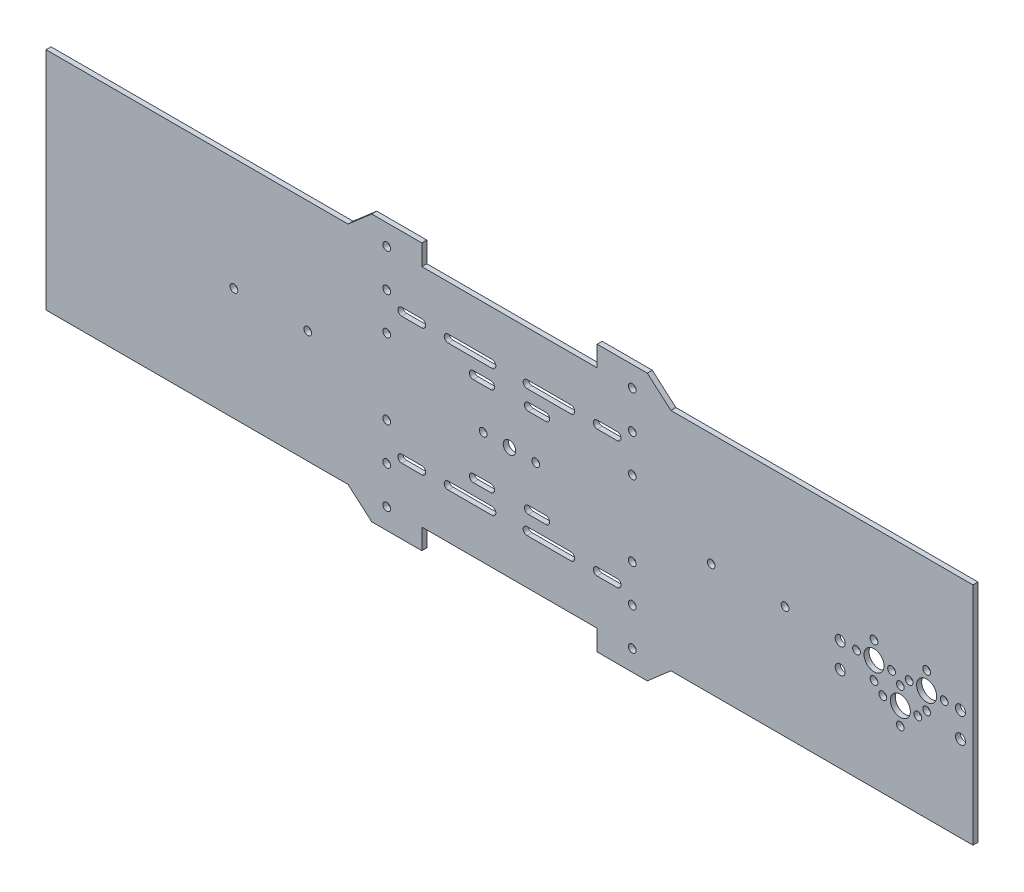
from build123d import *

# Parameters (mm, degrees)
SKETCH_1_R      = 1.55
SKETCH_1_R_2    = 2
SKETCH_1_R_3    = 4
SKETCH_1_R_4    = 2.5
EXTRUDE_1_DEPTH = 2


with BuildPart() as part:
    # 草图1 → 凸台-拉伸1 (new body)
    with BuildSketch(Plane.XY):
        Polygon((-35, 45), (35, 45), (35, 53.2), (55, 53.2), (64.431194454, 45), (185, 45), (185, -45), (64.431194454, -45), (55, -53.2), (35, -53.2), (35, -45), (-35, -45), (-35, -53.2), (-55, -53.2), (-64.431194454, -45), (-185, -45), (-185, 45), (-73.862388908, 45), (-64.431194454, 45), (-55, 53.2), (-35, 53.2), align=None)
        with Locations((49, -30)):
            Circle(SKETCH_1_R, mode=Mode.SUBTRACT)
        with Locations((49, -15)):
            Circle(SKETCH_1_R, mode=Mode.SUBTRACT)
        with Locations((10.5, 0)):
            Circle(SKETCH_1_R, mode=Mode.SUBTRACT)
        with Locations((-10.5, 0)):
            Circle(SKETCH_1_R, mode=Mode.SUBTRACT)
        with Locations((-49, -15)):
            Circle(SKETCH_1_R, mode=Mode.SUBTRACT)
        with Locations((-49, -30)):
            Circle(SKETCH_1_R, mode=Mode.SUBTRACT)
        with Locations((-49, 45)):
            Circle(SKETCH_1_R, mode=Mode.SUBTRACT)
        with Locations((49, 45)):
            Circle(SKETCH_1_R, mode=Mode.SUBTRACT)
        with Locations((-49, 30)):
            Circle(SKETCH_1_R, mode=Mode.SUBTRACT)
        with Locations((-49, 15)):
            Circle(SKETCH_1_R, mode=Mode.SUBTRACT)
        with Locations((49, 15)):
            Circle(SKETCH_1_R, mode=Mode.SUBTRACT)
        with Locations((49, 30)):
            Circle(SKETCH_1_R, mode=Mode.SUBTRACT)
        with Locations((49, -45)):
            Circle(SKETCH_1_R, mode=Mode.SUBTRACT)
        with Locations((-49, -45)):
            Circle(SKETCH_1_R, mode=Mode.SUBTRACT)
        with Locations((-80.5, 0)):
            Circle(SKETCH_1_R, mode=Mode.SUBTRACT)
        with Locations((-110, 0)):
            Circle(SKETCH_1_R, mode=Mode.SUBTRACT)
        with Locations((80.5, 0)):
            Circle(SKETCH_1_R, mode=Mode.SUBTRACT)
        with Locations((110, 0)):
            Circle(SKETCH_1_R, mode=Mode.SUBTRACT)
        with Locations((132, -0.8)):
            Circle(SKETCH_1_R_2, mode=Mode.SUBTRACT)
        with Locations((132, -10.8)):
            Circle(SKETCH_1_R_2, mode=Mode.SUBTRACT)
        with Locations((145.5, -0.8)):
            Circle(SKETCH_1_R_3, mode=Mode.SUBTRACT)
        with Locations((145.5, 6.2)):
            Circle(SKETCH_1_R, mode=Mode.SUBTRACT)
        with Locations((138.5, -0.8)):
            Circle(SKETCH_1_R, mode=Mode.SUBTRACT)
        with Locations((152.5, -0.8)):
            Circle(SKETCH_1_R, mode=Mode.SUBTRACT)
        with Locations((145.5, -7.8)):
            Circle(SKETCH_1_R, mode=Mode.SUBTRACT)
        with Locations((149, -11.3)):
            Circle(SKETCH_1_R, mode=Mode.SUBTRACT)
        with Locations((156, -4.3)):
            Circle(SKETCH_1_R, mode=Mode.SUBTRACT)
        with Locations((180, -10.8)):
            Circle(SKETCH_1_R_2, mode=Mode.SUBTRACT)
        with Locations((180, -0.8)):
            Circle(SKETCH_1_R_2, mode=Mode.SUBTRACT)
        with Locations((156, -18.3)):
            Circle(SKETCH_1_R, mode=Mode.SUBTRACT)
        with Locations((163, -11.3)):
            Circle(SKETCH_1_R, mode=Mode.SUBTRACT)
        with Locations((156, -11.3)):
            Circle(SKETCH_1_R_3, mode=Mode.SUBTRACT)
        with Locations((166.5, -0.8)):
            Circle(SKETCH_1_R_3, mode=Mode.SUBTRACT)
        with Locations((159.5, -0.8)):
            Circle(SKETCH_1_R, mode=Mode.SUBTRACT)
        with Locations((166.5, -7.8)):
            Circle(SKETCH_1_R, mode=Mode.SUBTRACT)
        with Locations((173.5, -0.8)):
            Circle(SKETCH_1_R, mode=Mode.SUBTRACT)
        with Locations((166.5, 6.2)):
            Circle(SKETCH_1_R, mode=Mode.SUBTRACT)
        Circle(SKETCH_1_R_4, mode=Mode.SUBTRACT)
        with BuildLine():
            Line((7.5, -16.25), (14.5, -16.25))
            ThreePointArc((14.5, -16.25), (16.05, -17.8), (14.5, -19.35))
            Line((14.5, -19.35), (7.5, -19.35))
            ThreePointArc((7.5, -19.35), (5.95, -17.8), (7.5, -16.25))
        make_face(mode=Mode.SUBTRACT)
        with BuildLine():
            Line((7, -23.85), (24.5, -23.85))
            ThreePointArc((24.5, -23.85), (26.05, -25.4), (24.5, -26.95))
            Line((24.5, -26.95), (7, -26.95))
            ThreePointArc((7, -26.95), (5.45, -25.4), (7, -23.85))
        make_face(mode=Mode.SUBTRACT)
        with BuildLine():
            Line((35, -23.85), (43, -23.85))
            ThreePointArc((43, -23.85), (44.55, -25.4), (43, -26.95))
            Line((43, -26.95), (35, -26.95))
            ThreePointArc((35, -26.95), (33.45, -25.4), (35, -23.85))
        make_face(mode=Mode.SUBTRACT)
        with BuildLine():
            Line((-35, -23.85), (-43, -23.85))
            ThreePointArc((-43, -23.85), (-44.55, -25.4), (-43, -26.95))
            Line((-43, -26.95), (-35, -26.95))
            ThreePointArc((-35, -26.95), (-33.45, -25.4), (-35, -23.85))
        make_face(mode=Mode.SUBTRACT)
        with BuildLine():
            Line((-7, -23.85), (-24.5, -23.85))
            ThreePointArc((-24.5, -23.85), (-26.05, -25.4), (-24.5, -26.95))
            Line((-24.5, -26.95), (-7, -26.95))
            ThreePointArc((-7, -26.95), (-5.45, -25.4), (-7, -23.85))
        make_face(mode=Mode.SUBTRACT)
        with BuildLine():
            Line((-7.5, -16.25), (-14.5, -16.25))
            ThreePointArc((-14.5, -16.25), (-16.05, -17.8), (-14.5, -19.35))
            Line((-14.5, -19.35), (-7.5, -19.35))
            ThreePointArc((-7.5, -19.35), (-5.95, -17.8), (-7.5, -16.25))
        make_face(mode=Mode.SUBTRACT)
        with BuildLine():
            Line((-7.5, 16.25), (-14.5, 16.25))
            ThreePointArc((-14.5, 16.25), (-16.05, 17.8), (-14.5, 19.35))
            Line((-14.5, 19.35), (-7.5, 19.35))
            ThreePointArc((-7.5, 19.35), (-5.95, 17.8), (-7.5, 16.25))
        make_face(mode=Mode.SUBTRACT)
        with BuildLine():
            Line((-7, 23.85), (-24.5, 23.85))
            ThreePointArc((-24.5, 23.85), (-26.05, 25.4), (-24.5, 26.95))
            Line((-24.5, 26.95), (-7, 26.95))
            ThreePointArc((-7, 26.95), (-5.45, 25.4), (-7, 23.85))
        make_face(mode=Mode.SUBTRACT)
        with BuildLine():
            Line((-35, 23.85), (-43, 23.85))
            ThreePointArc((-43, 23.85), (-44.55, 25.4), (-43, 26.95))
            Line((-43, 26.95), (-35, 26.95))
            ThreePointArc((-35, 26.95), (-33.45, 25.4), (-35, 23.85))
        make_face(mode=Mode.SUBTRACT)
        with BuildLine():
            Line((35, 23.85), (43, 23.85))
            ThreePointArc((43, 23.85), (44.55, 25.4), (43, 26.95))
            Line((43, 26.95), (35, 26.95))
            ThreePointArc((35, 26.95), (33.45, 25.4), (35, 23.85))
        make_face(mode=Mode.SUBTRACT)
        with BuildLine():
            Line((7, 23.85), (24.5, 23.85))
            ThreePointArc((24.5, 23.85), (26.05, 25.4), (24.5, 26.95))
            Line((24.5, 26.95), (7, 26.95))
            ThreePointArc((7, 26.95), (5.45, 25.4), (7, 23.85))
        make_face(mode=Mode.SUBTRACT)
        with BuildLine():
            Line((7.5, 16.25), (14.5, 16.25))
            ThreePointArc((14.5, 16.25), (16.05, 17.8), (14.5, 19.35))
            Line((14.5, 19.35), (7.5, 19.35))
            ThreePointArc((7.5, 19.35), (5.95, 17.8), (7.5, 16.25))
        make_face(mode=Mode.SUBTRACT)
    extrude(amount=EXTRUDE_1_DEPTH)


solid = part.part
